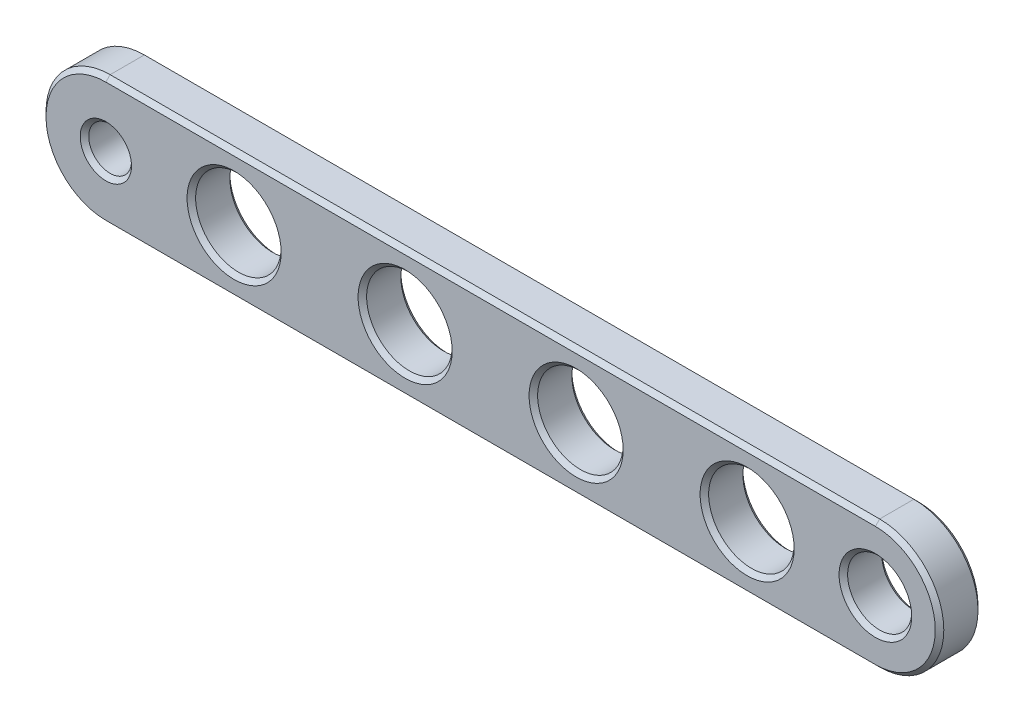
from build123d import *

# Parameters (mm, degrees)
SKETCH1_R           = 1
SKETCH1_R_2         = 1.5
SKETCH1_R_3         = 2
BOSS_EXTRUDE1_DEPTH = 2
CHAMFER1_SIZE       = 0.2


with BuildPart() as part:
    # Sketch1 → Boss-Extrude1 (new body)
    with BuildSketch(Plane.XY):
        with BuildLine():
            Line((-18, 3), (18, 3))
            ThreePointArc((18, 3), (21, 0), (18, -3))
            Line((18, -3), (-18, -3))
            ThreePointArc((-18, -3), (-21, 0), (-18, 3))
        make_face()
        with Locations((-18, 0)):
            Circle(SKETCH1_R, mode=Mode.SUBTRACT)
        with Locations((18, 0)):
            Circle(SKETCH1_R_2, mode=Mode.SUBTRACT)
        with Locations((-12, 0)):
            Circle(SKETCH1_R_3, mode=Mode.SUBTRACT)
        with Locations((-4, 0)):
            Circle(SKETCH1_R_3, mode=Mode.SUBTRACT)
        with Locations((4, 0)):
            Circle(SKETCH1_R_3, mode=Mode.SUBTRACT)
        with Locations((12, 0)):
            Circle(SKETCH1_R_3, mode=Mode.SUBTRACT)
    extrude(amount=BOSS_EXTRUDE1_DEPTH)

    # Chamfer1
    chamfer1_edges = [part.edges().sort_by_distance(p)[0] for p in [
        (-19, 0, 0),
        (-19, 0, 2),
        (21, 0, 2),
        (16.5, 0, 0),
        (16.5, 0, 2),
        (0, 3, 2),
        (-14, 0, 0),
        (-14, 0, 2),
        (-6, 0, 0),
        (-6, 0, 2),
        (2, 0, 0),
        (2, 0, 2),
        (10, 0, 0),
        (10, 0, 2),
        (-21, 0, 2),
        (0, 3, 0),
        (21, 0, 0),
        (0, -3, 0),
        (-21, 0, 0),
        (0, -3, 2),
    ]]
    chamfer(chamfer1_edges, length=CHAMFER1_SIZE)


solid = part.part
